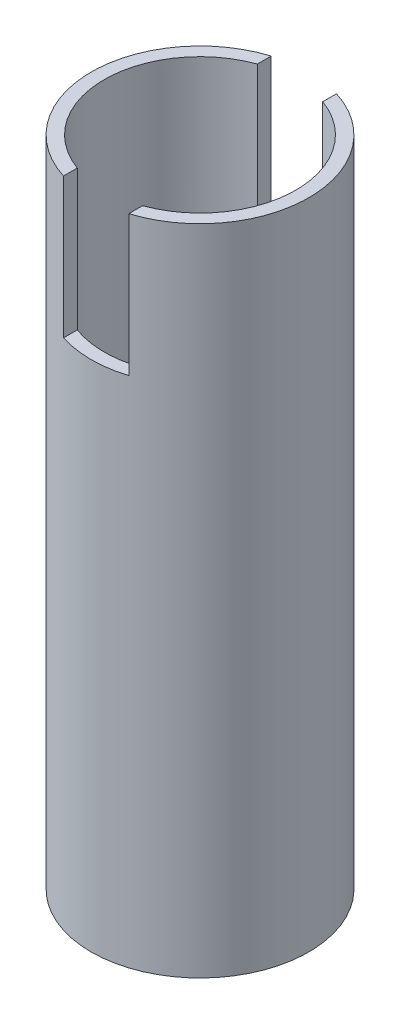
from build123d import *

# Parameters (mm, degrees)
ESBO_O1_R                = 25
ESBO_O1_R_2              = 22
RESSALTO_EXTRUS_O1_DEPTH = 150
CORTE_EXTRUS_O2_START    = -32.2
CORTE_EXTRUS_O2_DEPTH    = 32.2


with BuildPart() as part:
    # Esboço1 → Ressalto-extrusão1 (new body)
    with BuildSketch(Plane(origin=(0, 0, 0), x_dir=(1, 0, 0), z_dir=(0, 1, 0))):
        with Locations(Location((0, 0, 0), (0, 0, 270))):
            Circle(ESBO_O1_R)
        with Locations(Location((0, 0, 0), (0, 0, 270))):
            Circle(ESBO_O1_R_2, mode=Mode.SUBTRACT)
    extrude(amount=RESSALTO_EXTRUS_O1_DEPTH)

    # Esboço3 → Corte-extrusão2 (cut)
    with BuildSketch(Plane(origin=(0, 150, 0), x_dir=(1, 0, 0), z_dir=(0, 1, 0)).offset(CORTE_EXTRUS_O2_START)):
        with BuildLine():
            Line((7.5, -20.68211788), (7.5, -23.848480035))
            ThreePointArc((7.5, -23.848480035), (0, -25), (-7.5, -23.848480035))
            Line((-7.5, -23.848480035), (-7.5, -20.68211788))
            ThreePointArc((-7.5, -20.68211788), (0, -22), (7.5, -20.68211788))
        make_face()
        with BuildLine():
            Line((-7.5, 23.848480035), (-7.5, 20.68211788))
            ThreePointArc((-7.5, 20.68211788), (0, 22), (7.5, 20.68211788))
            Line((7.5, 20.68211788), (7.5, 23.848480035))
            ThreePointArc((7.5, 23.848480035), (0, 25), (-7.5, 23.848480035))
        make_face()
    extrude(amount=CORTE_EXTRUS_O2_DEPTH, mode=Mode.SUBTRACT)


solid = part.part
